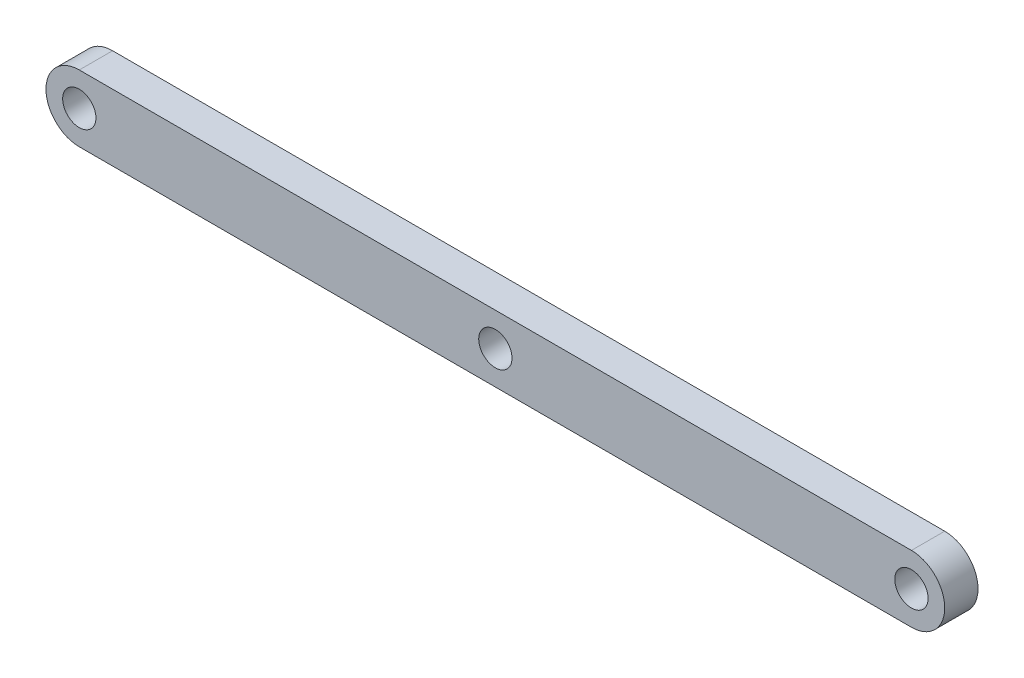
from build123d import *

# Parameters (mm, degrees)
SKETCH1_R           = 5
BOSS_EXTRUDE1_DEPTH = 5
SKETCH2_R           = 5
CUT_EXTRUDE2_DEPTH  = 5


with BuildPart() as part:
    # Sketch1 → Boss-Extrude1 (new, symmetric)
    with BuildSketch(Plane.XY):
        with BuildLine():
            Line((-125, 10), (125, 10))
            ThreePointArc((125, 10), (135, 0), (125, -10))
            Line((125, -10), (-125, -10))
            ThreePointArc((-125, -10), (-135, 0), (-125, 10))
        make_face()
        with Locations((-125, 0)):
            Circle(SKETCH1_R, mode=Mode.SUBTRACT)
        with Locations((125, 0)):
            Circle(SKETCH1_R, mode=Mode.SUBTRACT)
    extrude(amount=BOSS_EXTRUDE1_DEPTH, both=True)

    # Sketch2 → Cut-Extrude2 (cut, symmetric)
    with BuildSketch(Plane.XY):
        Circle(SKETCH2_R)
    extrude(amount=CUT_EXTRUDE2_DEPTH, both=True, mode=Mode.SUBTRACT)


solid = part.part
